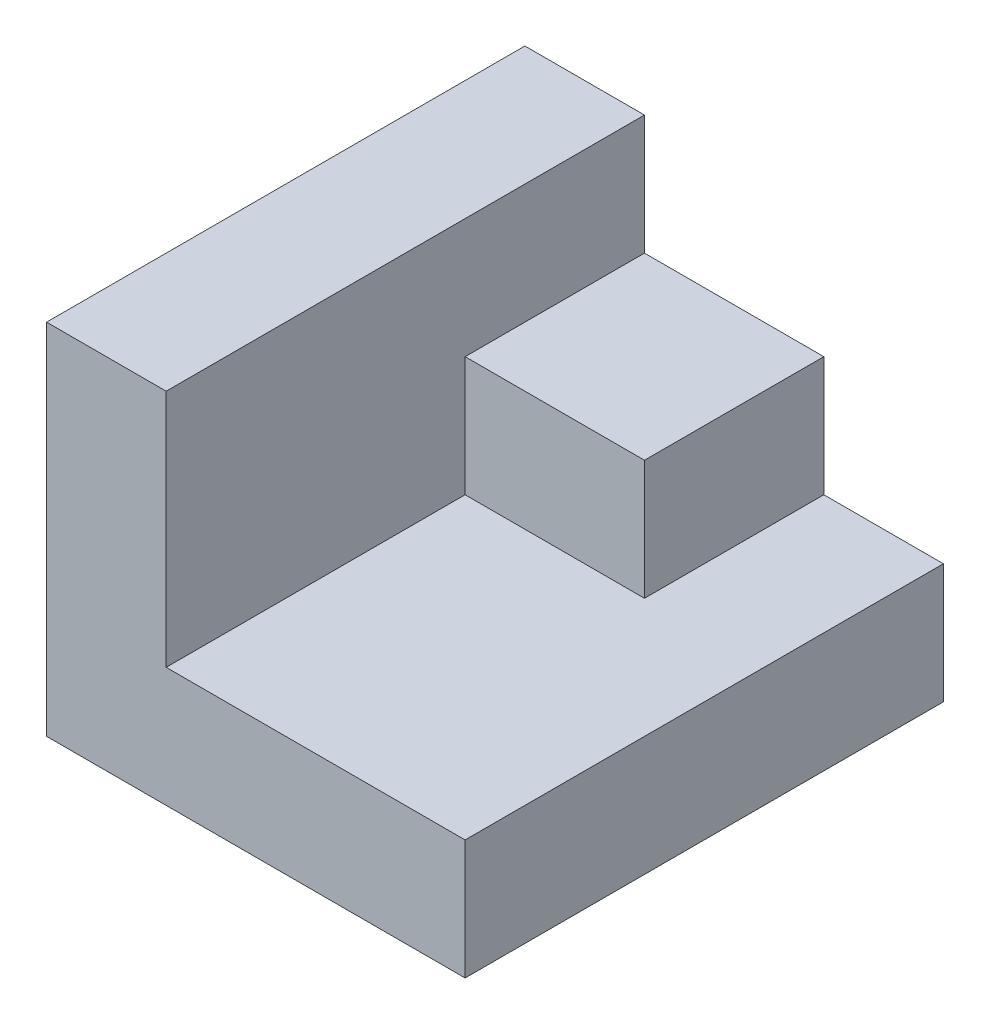
from build123d import *

# Parameters (mm, degrees)
BOSS_EXTRUDE1_DEPTH = 40
SKETCH2_W           = 15
SKETCH2_H           = 10
BOSS_EXTRUDE2_DEPTH = 15


with BuildPart() as part:
    # Sketch1 → Boss-Extrude1 (new body)
    with BuildSketch(Plane.XY):
        Polygon((0, 30), (0, 0), (35, 0), (35, 10), (10, 10), (10, 30), align=None)
    extrude(amount=-BOSS_EXTRUDE1_DEPTH)

    # Sketch2 → Boss-Extrude2 (add)
    with BuildSketch(Plane(origin=(0, 0, -40), x_dir=(-1, 0, 0), z_dir=(0, 0, -1))):
        with Locations((-17.5, 15)):
            Rectangle(SKETCH2_W, SKETCH2_H)
    extrude(amount=-BOSS_EXTRUDE2_DEPTH)


solid = part.part
